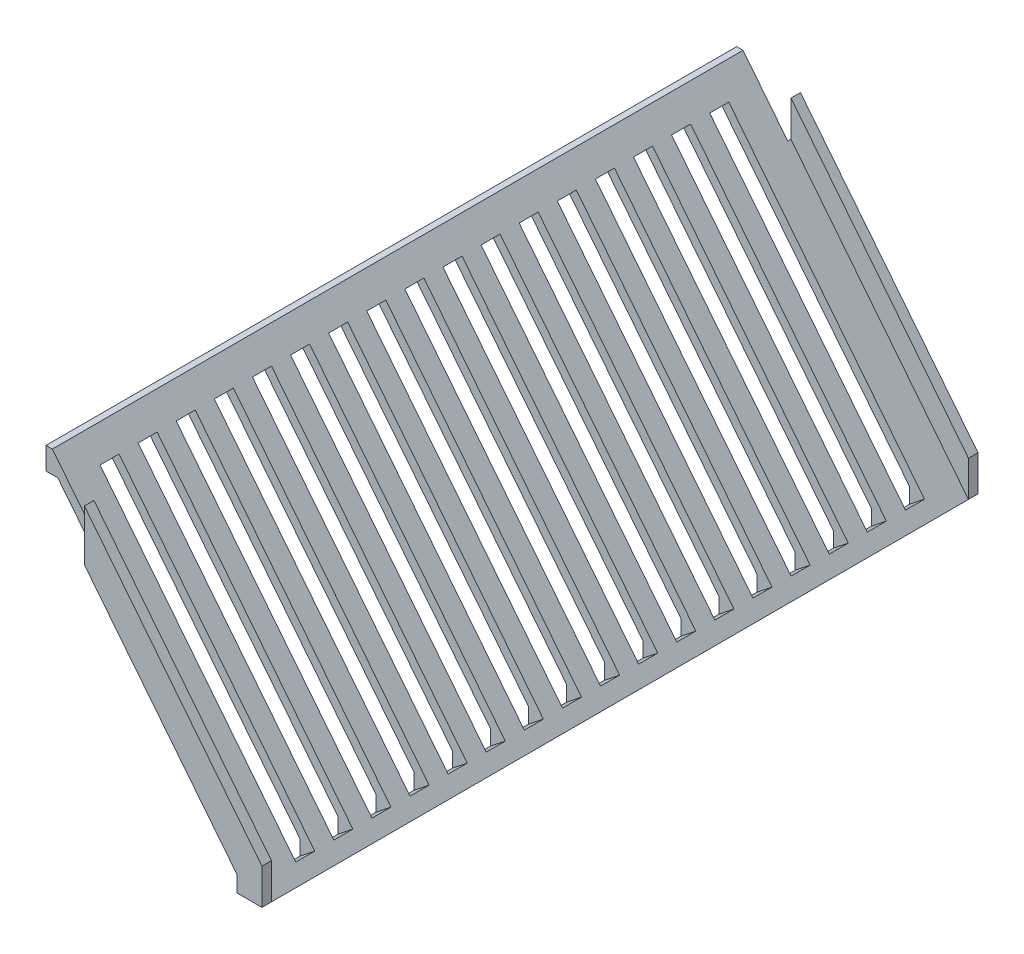
from build123d import *

# Parameters (mm, degrees)
EXTRUDE_1_DEPTH     = 112
EXTRUDE_START       = -2.25
EXTRUDE_2_DEPTH     = 3
SKETCH_9_W          = 6
SKETCH_9_H          = 99
CUT_EXTRUDE_3_DEPTH = 10
SKETCH_10_W         = 225.5
SKETCH_10_H         = 7
EXTRUDE_3_DEPTH     = 2
SKETCH_5_R          = 1.5
CUT_EXTRUDE_2_DEPTH = 2
CUT_EXTRUDE_4_DEPTH = 4


with BuildPart() as part:
    # 草图1 → 凸台-拉伸1 (new, symmetric)
    with BuildSketch(Plane.XY):
        Polygon((11.28405341, 15.648913828), (3.47340992, 15.648913828), (3.47340992, 20.648913828), (-56.981135534, 96.648913828), (-58.71594659, 96.648913828), (-58.71594659, 103.648913828), align=None)
    extrude(amount=EXTRUDE_1_DEPTH, both=True)

    # 草图8 → 凸台-拉伸2 (add)
    with BuildSketch(Plane(origin=(0, 0, -112), x_dir=(-1, 0, 0), z_dir=(0, 0, -1)).offset(EXTRUDE_START)):
        Polygon((-3.47340992, 15.648913828), (-11.28405341, 15.648913828), (-11.28405341, 26.893468065), (49.77141481, 103.648913828), (58.71594659, 103.648913828), (58.71594659, 96.648913828), (56.981135534, 96.648913828), (-3.47340992, 20.648913828), align=None)
    extrude_2 = extrude(amount=EXTRUDE_2_DEPTH)

    # 镜向1: 凸台-拉伸2 across plane
    add(extrude_2.mirror(Plane.XY))

    # 草图9 → 切除-拉伸3 (cut)
    with BuildSketch(Plane(origin=(14.535037867, 11.561961939, 0), x_dir=(0, 0, -1), z_dir=(0.7826010541756485, 0.6225235658215388, 0))):
        with Locations((12, 59.722267293)):
            Rectangle(SKETCH_9_W, SKETCH_9_H)
        with Locations((0, 59.722267293)):
            Rectangle(SKETCH_9_W, SKETCH_9_H)
        with Locations((24, 59.722267293)):
            Rectangle(SKETCH_9_W, SKETCH_9_H)
        with Locations((36, 59.722267293)):
            Rectangle(SKETCH_9_W, SKETCH_9_H)
        with Locations((48, 59.722267293)):
            Rectangle(SKETCH_9_W, SKETCH_9_H)
        with Locations((60, 59.722267293)):
            Rectangle(SKETCH_9_W, SKETCH_9_H)
        with Locations((72, 59.722267293)):
            Rectangle(SKETCH_9_W, SKETCH_9_H)
        with Locations((84, 59.722267293)):
            Rectangle(SKETCH_9_W, SKETCH_9_H)
        with Locations((96, 59.722267293)):
            Rectangle(SKETCH_9_W, SKETCH_9_H)
        with Locations((-12, 59.722267293)):
            Rectangle(SKETCH_9_W, SKETCH_9_H)
        with Locations((-24, 59.722267293)):
            Rectangle(SKETCH_9_W, SKETCH_9_H)
        with Locations((-36, 59.722267293)):
            Rectangle(SKETCH_9_W, SKETCH_9_H)
        with Locations((-48, 59.722267293)):
            Rectangle(SKETCH_9_W, SKETCH_9_H)
        with Locations((-60, 59.722267293)):
            Rectangle(SKETCH_9_W, SKETCH_9_H)
        with Locations((-72, 59.722267293)):
            Rectangle(SKETCH_9_W, SKETCH_9_H)
        with Locations((-84, 59.722267293)):
            Rectangle(SKETCH_9_W, SKETCH_9_H)
        with Locations((-96, 59.722267293)):
            Rectangle(SKETCH_9_W, SKETCH_9_H)
    extrude(amount=-CUT_EXTRUDE_3_DEPTH, mode=Mode.SUBTRACT)

    # 草图10 → 凸台-拉伸3 (add)
    with BuildSketch(Plane.ZY.offset(58.71594659)):
        with Locations((0, 100.148913828)):
            Rectangle(SKETCH_10_W, SKETCH_10_H)
    extrude(amount=EXTRUDE_3_DEPTH)

    # 草图5 → 切除-拉伸2 (cut)
    with BuildSketch(Plane.XZ.offset(-96.648913828)):
        with Locations(Location((-58.71594659, -86.5, 0), (0, 0, 270))):
            Circle(SKETCH_5_R)
        with Locations(Location((-58.71594659, 86.5, 0), (0, 0, 270))):
            Circle(SKETCH_5_R)
    extrude(amount=-CUT_EXTRUDE_2_DEPTH, mode=Mode.SUBTRACT)

    # 草图12 → 切除-拉伸4 (cut)
    with BuildSketch(Plane.XY.offset(112.75)):
        Polygon((-60.71594659, 103.648913828), (-60.71594659, 96.597994862), (-56.981135534, 96.648913828), (-44.624218302, 81.114503593), (-44.624218302, 97.178152504), (-49.77141481, 103.648913828), align=None)
    cut_extrude_4 = extrude(amount=-CUT_EXTRUDE_4_DEPTH, mode=Mode.SUBTRACT)

    # 镜向2: 切除-拉伸4 across plane
    add(cut_extrude_4.mirror(Plane.XY), mode=Mode.SUBTRACT)


solid = part.part
